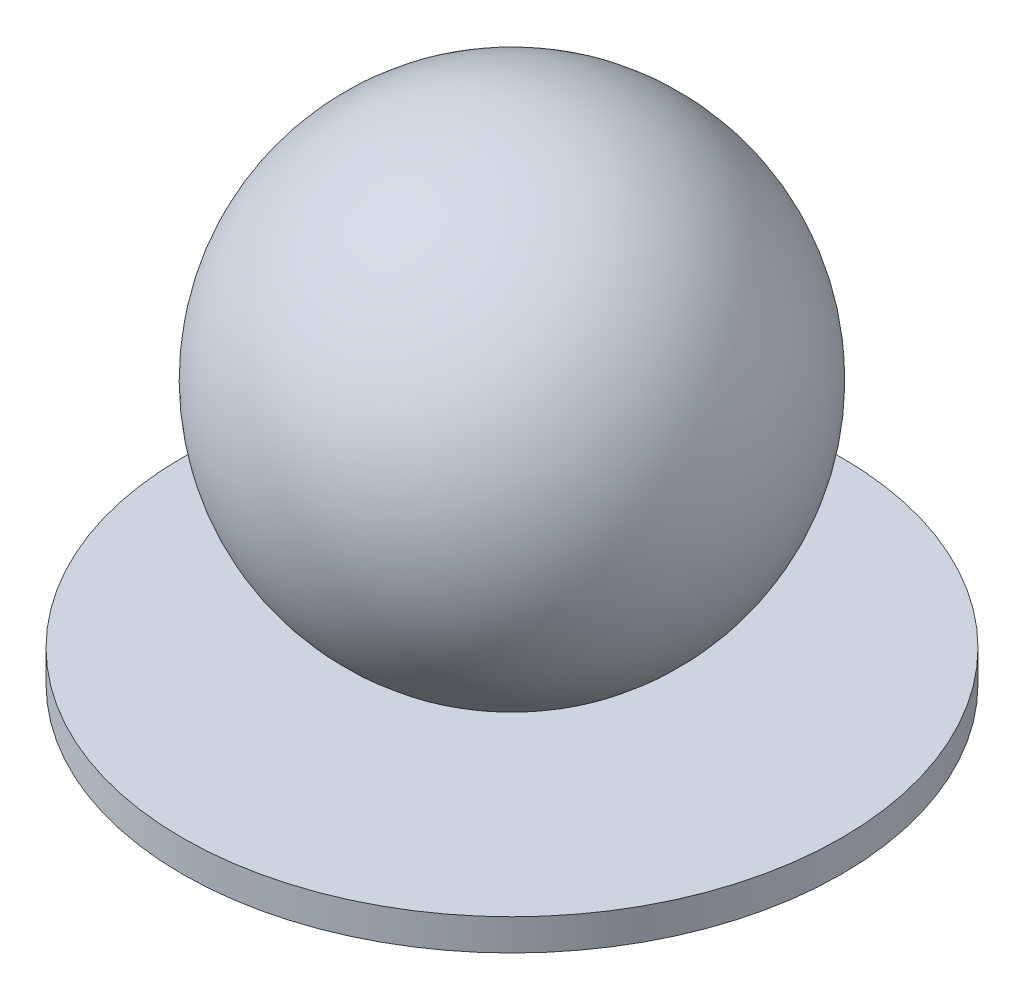
from build123d import *

# Parameters (mm, degrees)
SKETCH_3_R          = 10.5
EXTRUDE_1_DEPTH     = 1
SKETCH_4_R          = 0.75
CUT_EXTRUDE_1_DEPTH = 0.5


with BuildPart() as part:
    # 草图1 → 旋转4 (revolve)
    with BuildSketch(Plane.XY):
        with BuildLine():
            Line((0, 0), (0, 7.5))
            ThreePointArc((0, 7.5), (-7.5, 0), (0, -7.5))
            Line((0, -7.5), (0, 0))
        make_face()
    revolve(axis=Axis((0, 0, 0), (0, 1, 0)))


with BuildPart() as body_2:
    # 草图3 → 凸台-拉伸1 (new body)
    with BuildSketch(Plane(origin=(0, -7.4, 0), x_dir=(1, 0, 0), z_dir=(0, 1, 0))):
        with Locations(Location((0, 0, 0), (0, 0, 270))):
            Circle(SKETCH_3_R)
    extrude(amount=-EXTRUDE_1_DEPTH)

    # 草图4 → 切除-拉伸1 (cut)
    with BuildSketch(Plane.XZ.offset(8.4)):
        with Locations(Location((0, 0, 0), (0, 0, 270))):
            Circle(SKETCH_4_R)
    extrude(amount=-CUT_EXTRUDE_1_DEPTH, mode=Mode.SUBTRACT)


solid = Compound([part.part, body_2.part])
